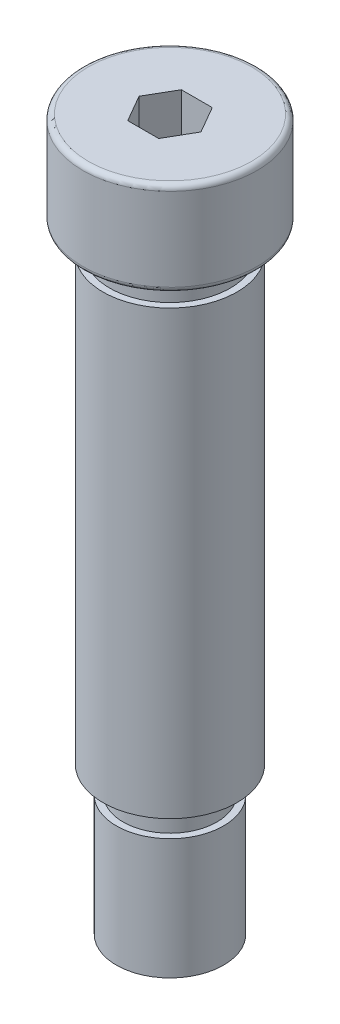
from build123d import *

# Parameters (mm, degrees)
CUT_EXTRUDE_1_DEPTH = 3.5


with BuildPart() as part:
    # 草图1 → 旋转1 (revolve)
    with BuildSketch(Plane.XY, mode=Mode.PRIVATE) as revolve_1_sk:
        with BuildLine():
            Line((0, 53), (-6.1, 53))
            ThreePointArc((-6.1, 53), (-6.382842712, 52.882842712), (-6.5, 52.6))
            Line((-6.5, 52.6), (-6.5, 46.4))
            ThreePointArc((-6.5, 46.4), (-6.382842712, 46.117157288), (-6.1, 46))
            Line((-6.1, 46), (-4.5, 46))
            Line((-4.5, 46), (-4.5, 44))
            Line((-4.5, 44), (-5, 44))
            Line((-5, 44), (-5, 11))
            Line((-5, 11), (-3.5, 11))
            Line((-3.5, 11), (-3.5, 9))
            Line((-3.5, 9), (-4, 9))
            Line((-4, 9), (-4, 0))
            Line((-4, 0), (0, 0))
            Line((0, 0), (0, 53))
        make_face()
    revolve(revolve_1_sk.sketch.rotate(Axis((0, 0, 0), (0, 1, 0)), 270), axis=Axis((0, 0, 0), (0, 1, 0)))

    # 草图2 → 切除-拉伸1 (cut)
    with BuildSketch(Plane(origin=(0, 53, 0), x_dir=(1, 0, 0), z_dir=(0, 1, 0))):
        Polygon((1.154700538, 2), (-1.154700538, 2), (-2.309401077, 0), (-1.154700538, -2), (1.154700538, -2), (2.309401077, 0), align=None)
    extrude(amount=-CUT_EXTRUDE_1_DEPTH, mode=Mode.SUBTRACT)


solid = part.part
